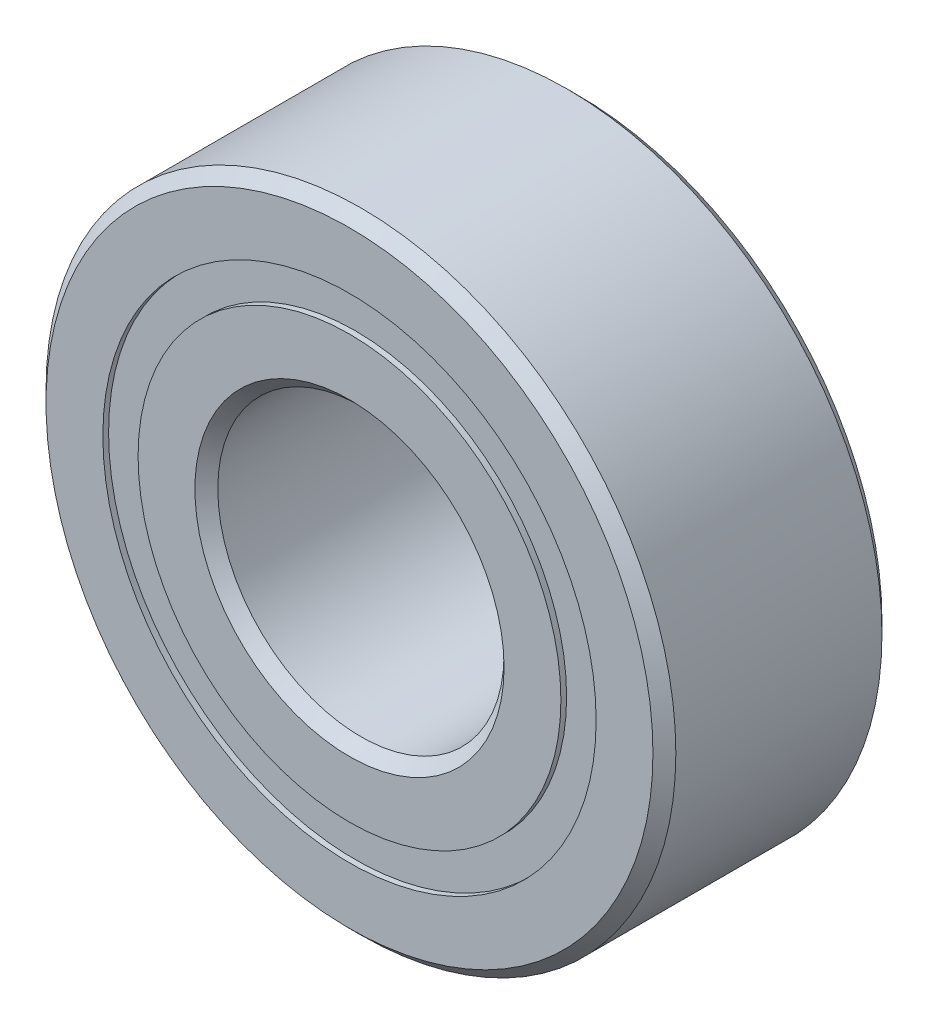
from build123d import *

# Parameters (mm, degrees)
CIRPATTERN1_COUNT = 12
SKETCH5_W         = 0.959362975
SKETCH5_H         = 0.615384616


with BuildPart() as part:
    # Sketch1 → Revolve1 (revolve)
    with BuildSketch(Plane(origin=(0, 0, 0), x_dir=(0, 0, -1), z_dir=(1, 0, 0))):
        with BuildLine():
            Line((1.8, 5.5), (-1.8, 5.5))
            Line((-1.8, 5.5), (-2, 5.3))
            Line((-2, 5.3), (-2, 4.307692308))
            Line((-2, 4.307692308), (-0.888888889, 4.307692308))
            ThreePointArc((-0.888888889, 4.307692308), (0, 4.940637025), (0.888888889, 4.307692308))
            Line((0.888888889, 4.307692308), (2, 4.307692308))
            Line((2, 4.307692308), (2, 5.3))
            Line((2, 5.3), (1.8, 5.5))
        make_face()
    revolve(axis=Axis((0, 0, 2), (0, 0, -1)))


with BuildPart() as body_2:
    # Sketch3 → Revolve3 (revolve)
    with BuildSketch(Plane(origin=(0, 0, 0), x_dir=(0, 0, -1), z_dir=(1, 0, 0))):
        with BuildLine():
            Line((-2, 3.692307692), (-0.888888889, 3.692307692))
            ThreePointArc((-0.888888889, 3.692307692), (0, 3.059362975), (0.888888889, 3.692307692))
            Line((0.888888889, 3.692307692), (2, 3.692307692))
            Line((2, 3.692307692), (2, 2.7))
            Line((2, 2.7), (1.8, 2.5))
            Line((1.8, 2.5), (-1.8, 2.5))
            Line((-1.8, 2.5), (-2, 2.7))
            Line((-2, 2.7), (-2, 3.692307692))
        make_face()
    revolve(axis=Axis((0, 0, 2), (0, 0, -1)))


with BuildPart() as body_3:
    # Sketch4 → Revolve4 (revolve)
    with BuildSketch(Plane(origin=(0, 0, 0), x_dir=(0, 0, -1), z_dir=(1, 0, 0))):
        with BuildLine():
            Line((-0.940637025, 4), (0.940637025, 4))
            ThreePointArc((0.940637025, 4), (0, 4.940637025), (-0.940637025, 4))
        make_face()
    revolve(axis=Axis((0, 4, 0.940637025), (0, 0, -1)))


with BuildPart() as cirpattern1_1:
    # CirPattern1: pattern copy
    add(body_3.part.rotate(Axis((0, 0, -2), (0, 0, 1)), 1 * 360 / CIRPATTERN1_COUNT))


with BuildPart() as cirpattern1_2:
    # CirPattern1: pattern copy
    add(body_3.part.rotate(Axis((0, 0, -2), (0, 0, 1)), 2 * 360 / CIRPATTERN1_COUNT))


with BuildPart() as cirpattern1_3:
    # CirPattern1: pattern copy
    add(body_3.part.rotate(Axis((0, 0, -2), (0, 0, 1)), 3 * 360 / CIRPATTERN1_COUNT))


with BuildPart() as cirpattern1_4:
    # CirPattern1: pattern copy
    add(body_3.part.rotate(Axis((0, 0, -2), (0, 0, 1)), 4 * 360 / CIRPATTERN1_COUNT))


with BuildPart() as cirpattern1_5:
    # CirPattern1: pattern copy
    add(body_3.part.rotate(Axis((0, 0, -2), (0, 0, 1)), 5 * 360 / CIRPATTERN1_COUNT))


with BuildPart() as cirpattern1_6:
    # CirPattern1: pattern copy
    add(body_3.part.rotate(Axis((0, 0, -2), (0, 0, 1)), 6 * 360 / CIRPATTERN1_COUNT))


with BuildPart() as cirpattern1_7:
    # CirPattern1: pattern copy
    add(body_3.part.rotate(Axis((0, 0, -2), (0, 0, 1)), 7 * 360 / CIRPATTERN1_COUNT))


with BuildPart() as cirpattern1_8:
    # CirPattern1: pattern copy
    add(body_3.part.rotate(Axis((0, 0, -2), (0, 0, 1)), 8 * 360 / CIRPATTERN1_COUNT))


with BuildPart() as cirpattern1_9:
    # CirPattern1: pattern copy
    add(body_3.part.rotate(Axis((0, 0, -2), (0, 0, 1)), 9 * 360 / CIRPATTERN1_COUNT))


with BuildPart() as cirpattern1_10:
    # CirPattern1: pattern copy
    add(body_3.part.rotate(Axis((0, 0, -2), (0, 0, 1)), 10 * 360 / CIRPATTERN1_COUNT))


with BuildPart() as cirpattern1_11:
    # CirPattern1: pattern copy
    add(body_3.part.rotate(Axis((0, 0, -2), (0, 0, 1)), 11 * 360 / CIRPATTERN1_COUNT))


with BuildPart() as body_15:
    # Sketch5 → Revolve5 (revolve)
    with BuildSketch(Plane(origin=(0, 0, 0), x_dir=(0, 0, -1), z_dir=(1, 0, 0))):
        with Locations((-1.420318513, 4)):
            Rectangle(SKETCH5_W, SKETCH5_H)
        with Locations((1.420318513, 4)):
            Rectangle(SKETCH5_W, SKETCH5_H)
    revolve(axis=Axis((0, 0, 2), (0, 0, -1)))


solid = Compound([part.part, body_2.part, body_3.part, cirpattern1_1.part, cirpattern1_2.part, cirpattern1_3.part, cirpattern1_4.part, cirpattern1_5.part, cirpattern1_6.part, cirpattern1_7.part, cirpattern1_8.part, cirpattern1_9.part, cirpattern1_10.part, cirpattern1_11.part, body_15.part])
